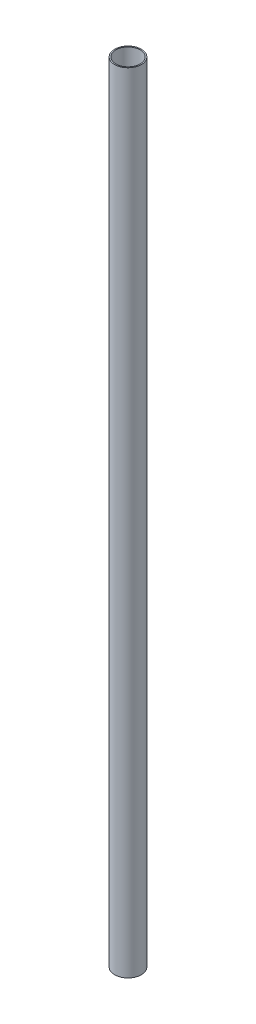
from build123d import *

# Parameters (mm, degrees)
SKETCH1_R          = 98.5
SKETCH1_R_2        = 90
ROCKET_SHELL_DEPTH = 5822
SKETCH2_R          = 90
SKETCH2_R_2        = 50
SOLID_FUEL_DEPTH   = 1673
SKETCH3_R          = 90
LIQUID_FUEL_DEPTH  = 2900
SKETCH4_R          = 90
CUT_CORE_OUT_DEPTH = 400


with BuildPart() as part:
    # Sketch1 → Rocket Shell (new body)
    with BuildSketch(Plane(origin=(0, 0, 0), x_dir=(1, 0, 0), z_dir=(0, 1, 0))):
        with Locations(Location((0, 0, 0), (0, 0, 270))):
            Circle(SKETCH1_R)
        with Locations(Location((0, 0, 0), (0, 0, 270))):
            Circle(SKETCH1_R_2, mode=Mode.SUBTRACT)
    extrude(amount=ROCKET_SHELL_DEPTH)


with BuildPart() as body_2:
    # Sketch2 → Solid Fuel (new body)
    with BuildSketch(Plane.XZ):
        with Locations(Location((0, 0, 0), (0, 0, 270))):
            Circle(SKETCH2_R)
        with Locations(Location((0, 0, 0), (0, 0, 270))):
            Circle(SKETCH2_R_2, mode=Mode.SUBTRACT)
    extrude(amount=-SOLID_FUEL_DEPTH)


with BuildPart() as body_3:
    # Sketch3 → Liquid Fuel (new body)
    with BuildSketch(Plane(origin=(0, 1673, 0), x_dir=(1, 0, 0), z_dir=(0, 1, 0))):
        with Locations(Location((0, 0, 0), (0, 0, 270))):
            Circle(SKETCH3_R)
    extrude(amount=LIQUID_FUEL_DEPTH)

    # Sketch4 → Cut Core Out (cut)
    with BuildSketch(Plane.XZ.offset(-1673)):
        with Locations(Location((0, 0, 0), (0, 0, 270))):
            Circle(SKETCH4_R)
    extrude(amount=-CUT_CORE_OUT_DEPTH, mode=Mode.SUBTRACT)


solid = Compound([part.part, body_2.part, body_3.part])
